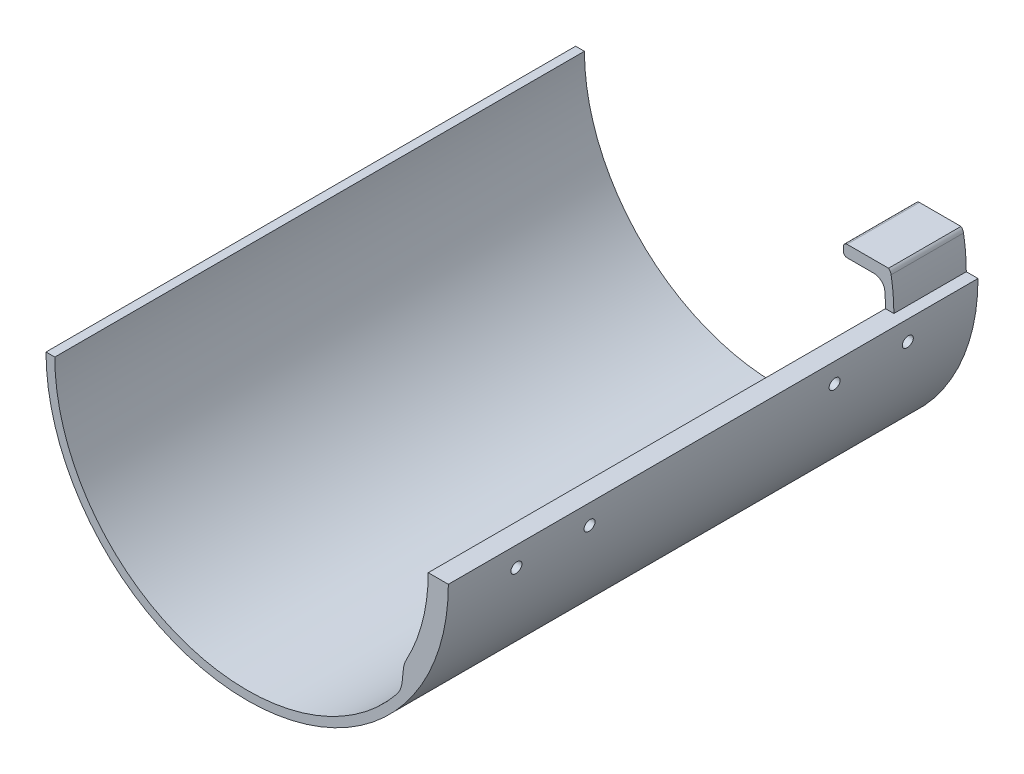
from build123d import *

# Parameters (mm, degrees)
EXTRUDE_1_DEPTH     = 144.8
SKETCH_7_R          = 1.5
CUT_EXTRUDE_6_DEPTH = 80
CUT_EXTRUDE_START   = -125
CUT_EXTRUDE_8_DEPTH = 125


with BuildPart() as part:
    # 草图1 → 凸台-拉伸1 (new body)
    with BuildSketch(Plane.XY):
        with BuildLine():
            Line((-55, 0), (-52.6, 0))
            ThreePointArc((-52.6, 0), (-17.5838694, -49.573859411), (40.843632582, -33.144496941))
            ThreePointArc((40.843632582, -33.144496941), (41.8776275, -31.406850611), (42.371810697, -29.446150933))
            Line((42.371810697, -29.446150933), (42.701389329, -26.225087281))
            ThreePointArc((42.701389329, -26.225087281), (42.976584625, -24.872497257), (43.511842068, -23.600203386))
            ThreePointArc((43.511842068, -23.600203386), (48.437324754, -10.201743511), (49.33443696, 4.04516129))
            ThreePointArc((49.33443696, 4.04516129), (48.377266711, 6.006295976), (46.344471083, 6.8))
            Line((46.344471083, 6.8), (39, 6.8))
            ThreePointArc((39, 6.8), (38.292893219, 7.092893219), (38, 7.8))
            Line((38, 7.8), (38, 9))
            ThreePointArc((38, 9), (38.292893219, 9.707106781), (39, 10))
            Line((39, 10), (50.344019583, 10))
            ThreePointArc((50.344019583, 10), (50.805346897, 9.459374484), (51.0484918, 8.791557597))
            ThreePointArc((51.0484918, 8.791557597), (51.611780996, 4.411809423), (51.8, 0))
            Line((51.8, 0), (55, 0))
            ThreePointArc((55, 0), (0, -55), (-55, 0))
        make_face()
    extrude(amount=EXTRUDE_1_DEPTH)

    # 草图7 → 切除-拉伸6 (cut)
    with BuildSketch(Plane(origin=(0, 0, 0), x_dir=(0.10066073352284005, 0.994920809274107, 0), z_dir=(-0.9949208092741069, 0.10066073352284004, 0))):
        with Locations(Location((-0.136340344, -18.9, 0), (0, 0, 180))):
            Circle(SKETCH_7_R)
        with Locations(Location((-0.136340344, -38.9, 0), (0, 0, 180))):
            Circle(SKETCH_7_R)
        with Locations(Location((-0.136340344, -105.9, 0), (0, 0, 180))):
            Circle(SKETCH_7_R)
        with Locations(Location((-0.136340344, -125.9, 0), (0, 0, 180))):
            Circle(SKETCH_7_R)
    extrude(amount=-CUT_EXTRUDE_6_DEPTH, mode=Mode.SUBTRACT)

    # 草图4 → 切除-拉伸8 (cut)
    with BuildSketch(Plane.XY.offset(144.8).offset(CUT_EXTRUDE_START)):
        with BuildLine():
            Line((55, 0), (0, 0))
            Line((0, 0), (50.016978469, 22.875792113))
            ThreePointArc((50.016978469, 22.875792113), (53.739807479, 11.70611345), (55, 0))
        make_face()
    extrude(amount=CUT_EXTRUDE_8_DEPTH, mode=Mode.SUBTRACT)


solid = part.part
